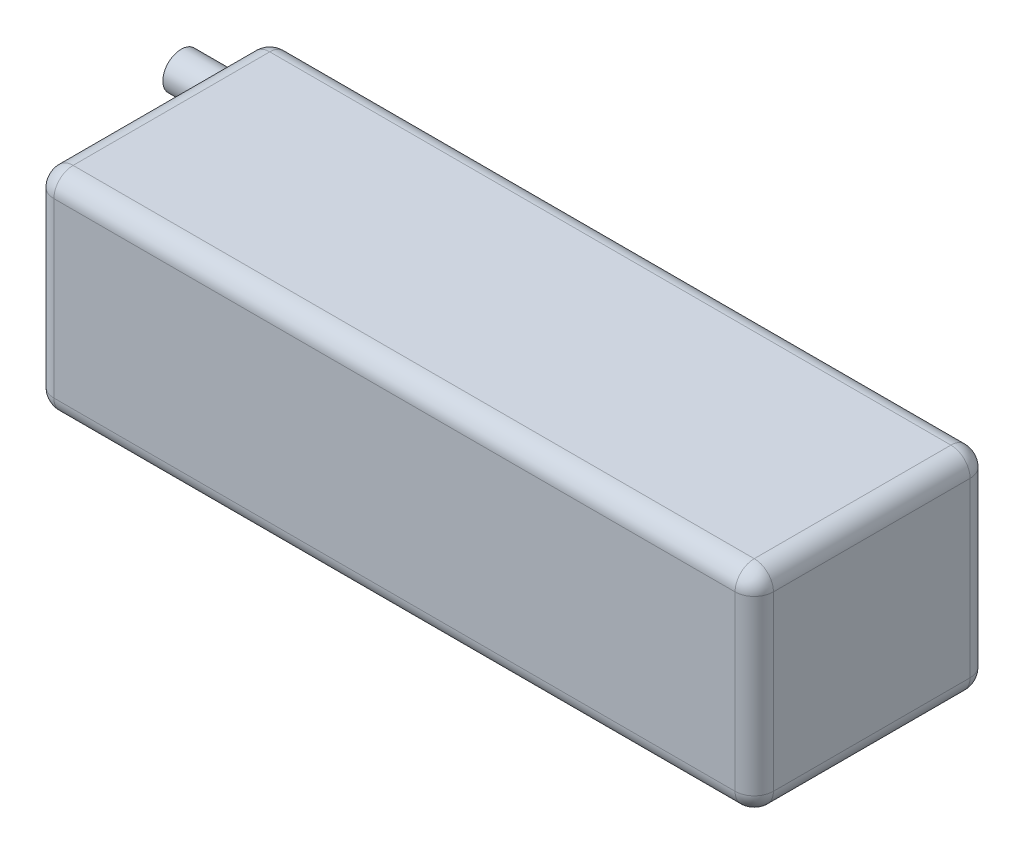
from build123d import *

# Parameters (mm, degrees)
SKETCH1_W             = 150
SKETCH1_H             = 49
BOSS_EXTRUDE1_DEPTH   = 44
SKETCH2_R             = 3.824497405
BOSS_EXTRUDE2_DEPTH   = 10
BOSS_EXTRUDE2_2_DEPTH = 10
FILLET1_R             = 4


with BuildPart() as part:
    # Sketch1 → Boss-Extrude1 (new body)
    with BuildSketch(Plane(origin=(0, 0, 0), x_dir=(1, 0, 0), z_dir=(0, 1, 0))):
        with Locations((75, 24.5)):
            Rectangle(SKETCH1_W, SKETCH1_H)
    extrude(amount=BOSS_EXTRUDE1_DEPTH)

    # Fillet1
    fillet1_edges = [part.edges().sort_by_distance(p)[0] for p in [
        (150, 44, -24.5),
        (75, 44, -49),
        (0, 44, -24.5),
        (75, 0, -49),
        (150, 0, -24.5),
        (75, 0, 0),
        (0, 0, -24.5),
        (0, 22, -49),
        (150, 22, -49),
        (150, 22, 0),
        (0, 22, 0),
        (75, 44, 0),
    ]]
    fillet(fillet1_edges, radius=FILLET1_R)


with BuildPart() as body_2:
    # Sketch2 → Boss-Extrude2 (new body)
    with BuildSketch(Plane.ZY):
        with Locations((-40.529448577, 35.886898519)):
            Circle(SKETCH2_R)
    extrude(amount=BOSS_EXTRUDE2_DEPTH)


with BuildPart() as body_3:
    # Sketch2 → Boss-Extrude2 2 (new body)
    with BuildSketch(Plane.ZY):
        with Locations((-40.529448577, 8.906638539)):
            Circle(SKETCH2_R)
    extrude(amount=BOSS_EXTRUDE2_2_DEPTH)


solid = Compound([part.part, body_2.part, body_3.part])
